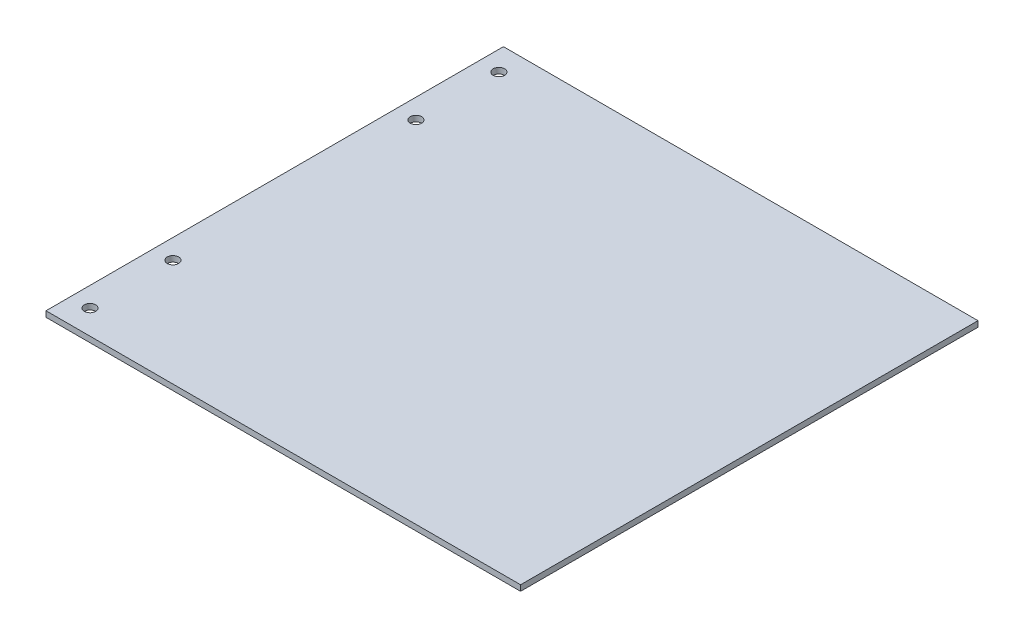
from build123d import *

# Parameters (mm, degrees)
SKETCH_1_W      = 166
SKETCH_1_H      = 160
EXTRUDE_1_DEPTH = 2
MM_2_D          = 4
MM_2_DEPTH      = 10
MM_2_TIP        = 1.201721238


with BuildPart() as part:
    # 草图1 → 凸台-拉伸1 (new body)
    with BuildSketch(Plane(origin=(0, 0, 0), x_dir=(1, 0, 0), z_dir=(0, 1, 0))):
        Rectangle(SKETCH_1_W, SKETCH_1_H)
    extrude(amount=EXTRUDE_1_DEPTH)

    # 大小mm 暗销孔2
    with Locations(Plane(origin=(45.636831669, 2.8, 467.05931397), x_dir=(0.07852837759024327, 0, 0.9969118787099711), z_dir=(0, 1, 0))):
        with Locations((-404.949854974, -103.656881575), (-403.897574678, -90.298262111), (-432.80801916, -88.020939161), (-433.860299457, -101.379558625), (-547.50825363, -92.42732358), (-518.597809147, -94.70464653), (-517.545528888, -81.346027355), (-546.45597337, -79.068704405)):
            Hole(MM_2_D / 2, depth=MM_2_DEPTH)
            with Locations((0, 0, -(MM_2_DEPTH + MM_2_TIP / 2))):  # 118° drill point
                Cone(0, MM_2_D / 2, MM_2_TIP, mode=Mode.SUBTRACT)


solid = part.part
